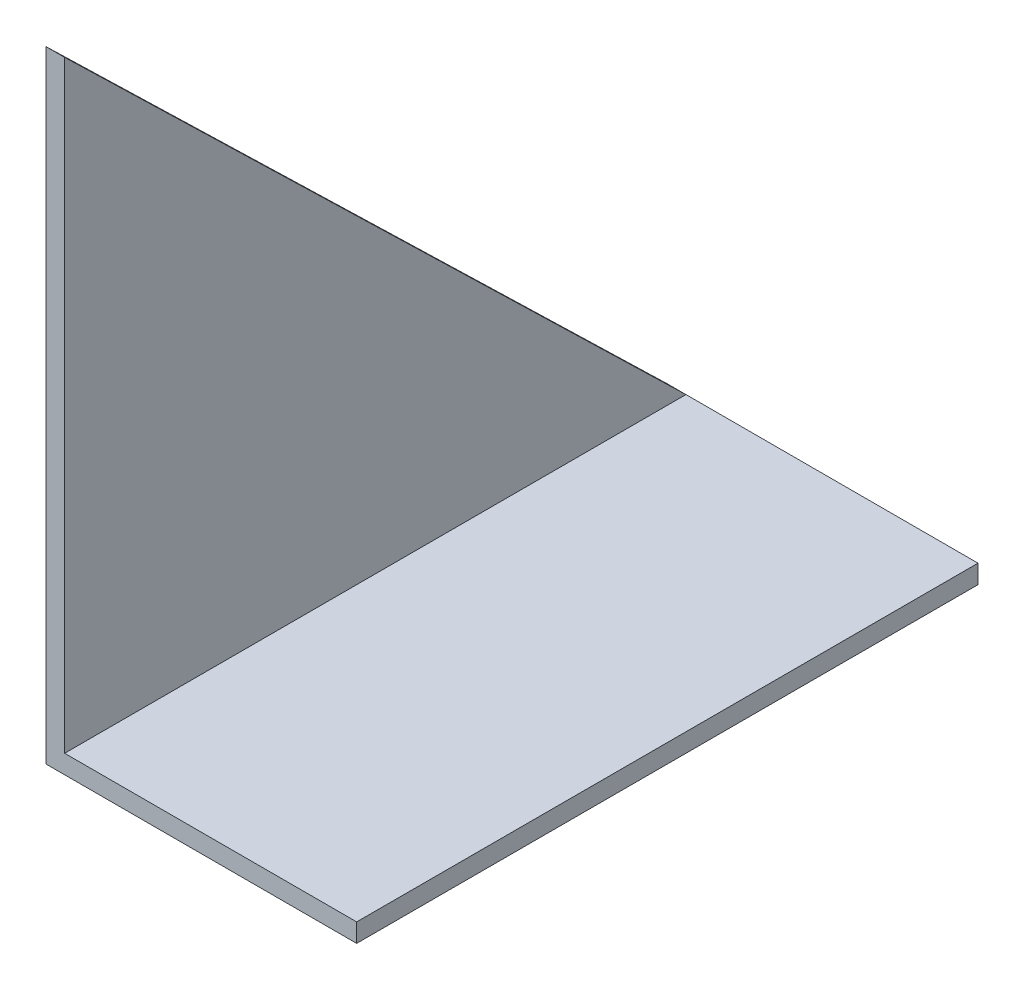
from build123d import *

# Parameters (mm, degrees)
CROQUIS1_W              = 3
CROQUIS1_H              = 100
CROQUIS1_W_2            = 47
CROQUIS1_H_2            = 3
SALIENTE_EXTRUIR1_DEPTH = 50
CORTAR_EXTRUIR1_DEPTH   = 100


with BuildPart() as part:
    # Croquis1 → Saliente-Extruir1 (new, symmetric)
    with BuildSketch(Plane.XY):
        Rectangle(CROQUIS1_W, CROQUIS1_H)
        with Locations((25, -48.5)):
            Rectangle(CROQUIS1_W_2, CROQUIS1_H_2)
    extrude(amount=SALIENTE_EXTRUIR1_DEPTH, both=True)

    # Croquis2 → Cortar-Extruir1 (cut)
    with BuildSketch(Plane(origin=(1.5, 0, 0), x_dir=(0, 0, -1), z_dir=(1, 0, 0))):
        Polygon((-50, 50), (50, -47), (50, 50), align=None)
    extrude(amount=-CORTAR_EXTRUIR1_DEPTH, mode=Mode.SUBTRACT)


solid = part.part
